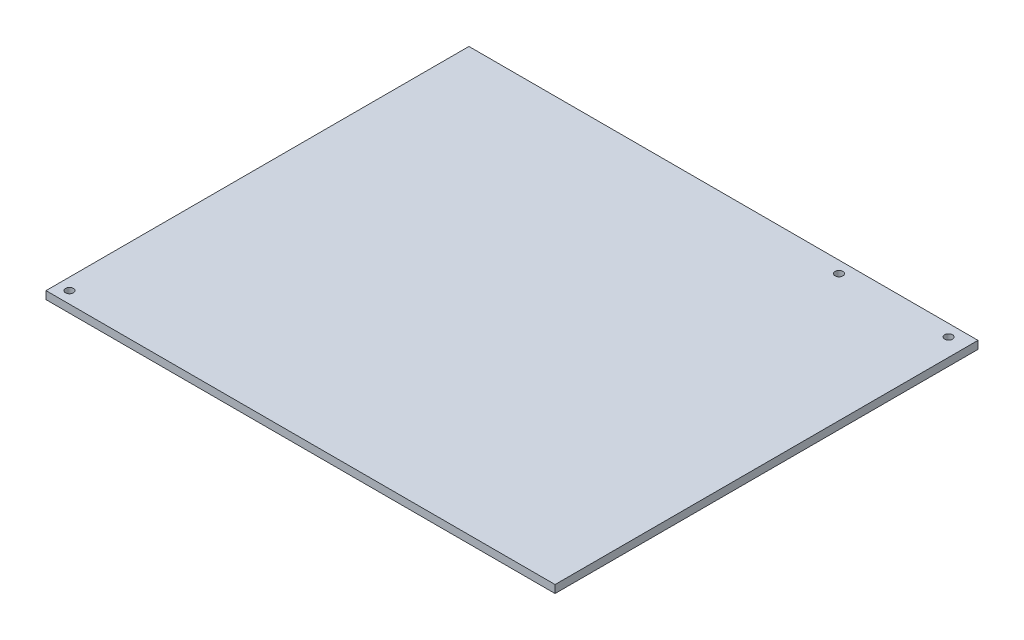
from build123d import *

# Parameters (mm, degrees)
SKETCH1_W           = 130
SKETCH1_H           = 108
SKETCH1_R           = 1
BOSS_EXTRUDE1_DEPTH = 2


with BuildPart() as part:
    # Sketch1 → Boss-Extrude1 (new body)
    with BuildSketch(Plane(origin=(0, 0, 0), x_dir=(1, 0, 0), z_dir=(0, 1, 0))):
        with Locations((65, 54)):
            Rectangle(SKETCH1_W, SKETCH1_H)
        with Locations(Location((3, 3, 0), (0, 0, 270))):
            Circle(SKETCH1_R, mode=Mode.SUBTRACT)
        with Locations(Location((125.5, 105, 0), (0, 0, 270))):
            Circle(SKETCH1_R, mode=Mode.SUBTRACT)
        with Locations(Location((97.5, 105, 0), (0, 0, 270))):
            Circle(SKETCH1_R, mode=Mode.SUBTRACT)
    extrude(amount=BOSS_EXTRUDE1_DEPTH)


solid = part.part
